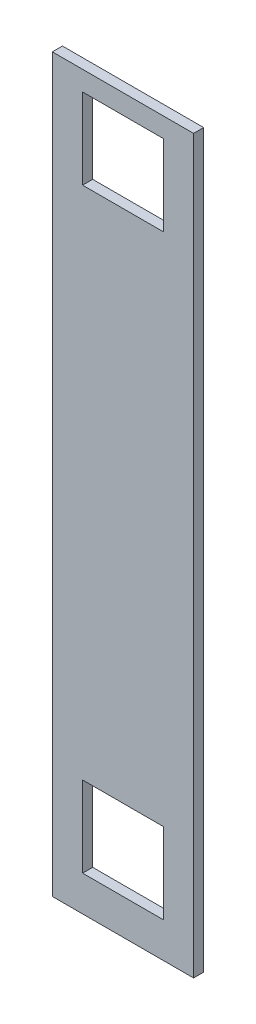
from build123d import *

# Parameters (mm, degrees)
SKETCH1_W           = 177.8
SKETCH1_H           = 920.75
BOSS_EXTRUDE1_DEPTH = 12.7
CUT_EXTRUDE1_REACH  = 471.052
SKETCH2_W           = 101.6
SKETCH2_H           = 101.6


with BuildPart() as part:
    # Sketch1 → Boss-Extrude1 (new body)
    with BuildSketch(Plane.XY):
        Rectangle(SKETCH1_W, SKETCH1_H)
    extrude(amount=BOSS_EXTRUDE1_DEPTH)

    # Sketch2 → Cut-Extrude1 (cut, up to next)
    with BuildSketch(Plane(origin=(0, 0, 0), x_dir=(-1, 0, 0), z_dir=(0, 0, -1)), mode=Mode.PRIVATE) as cut_extrude1_sk1:
        with Locations((0, -365.125)):
            Rectangle(SKETCH2_W, SKETCH2_H)
    cut_extrude1_tool1 = extrude(cut_extrude1_sk1.sketch, amount=-CUT_EXTRUDE1_REACH, mode=Mode.PRIVATE) & part.part
    # Sketch2 → Cut-Extrude1 (cut, up to next)
    with BuildSketch(Plane(origin=(0, 0, 0), x_dir=(-1, 0, 0), z_dir=(0, 0, -1)), mode=Mode.PRIVATE) as cut_extrude1_sk2:
        with Locations((0, 384.875)):
            Rectangle(SKETCH2_W, SKETCH2_H)
    cut_extrude1_tool2 = extrude(cut_extrude1_sk2.sketch, amount=-CUT_EXTRUDE1_REACH, mode=Mode.PRIVATE) & part.part
    add(cut_extrude1_tool1.solids().sort_by_distance((0, -365.125, 0))[0], mode=Mode.SUBTRACT)
    add(cut_extrude1_tool2.solids().sort_by_distance((0, 384.875, 0))[0], mode=Mode.SUBTRACT)


solid = part.part
